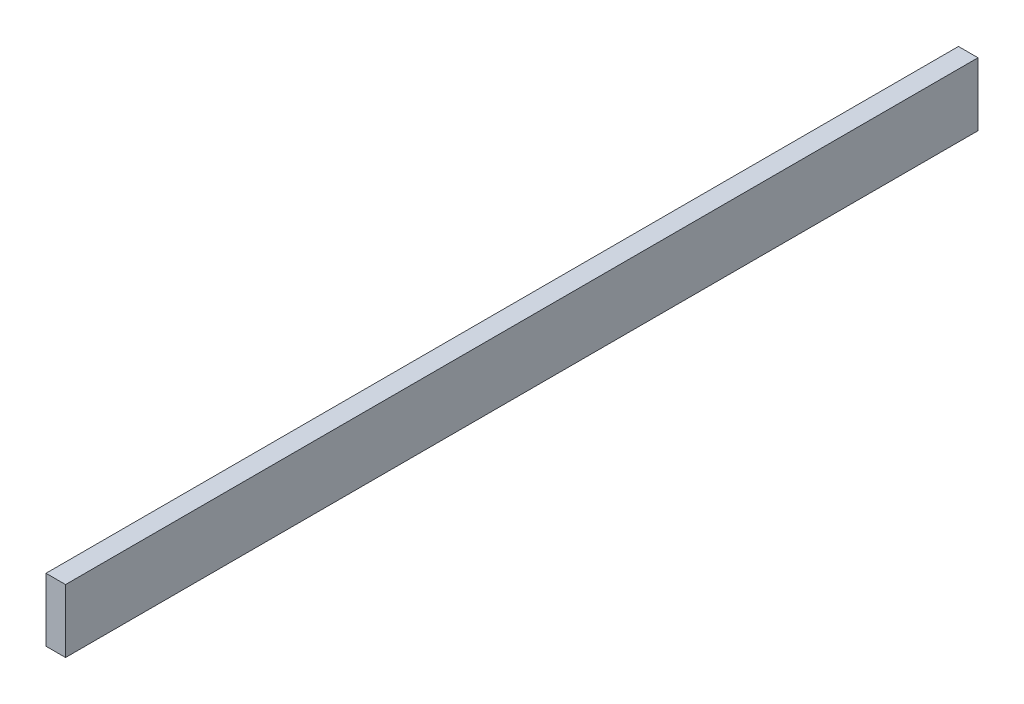
from build123d import *

# Parameters (mm, degrees)
SKETCH1_W           = 18
SKETCH1_H           = 58.2
BOSS_EXTRUDE1_DEPTH = 840


with BuildPart() as part:
    # Sketch1 → Boss-Extrude1 (new body)
    with BuildSketch(Plane.XY):
        Rectangle(SKETCH1_W, SKETCH1_H)
    extrude(amount=BOSS_EXTRUDE1_DEPTH)


solid = part.part
